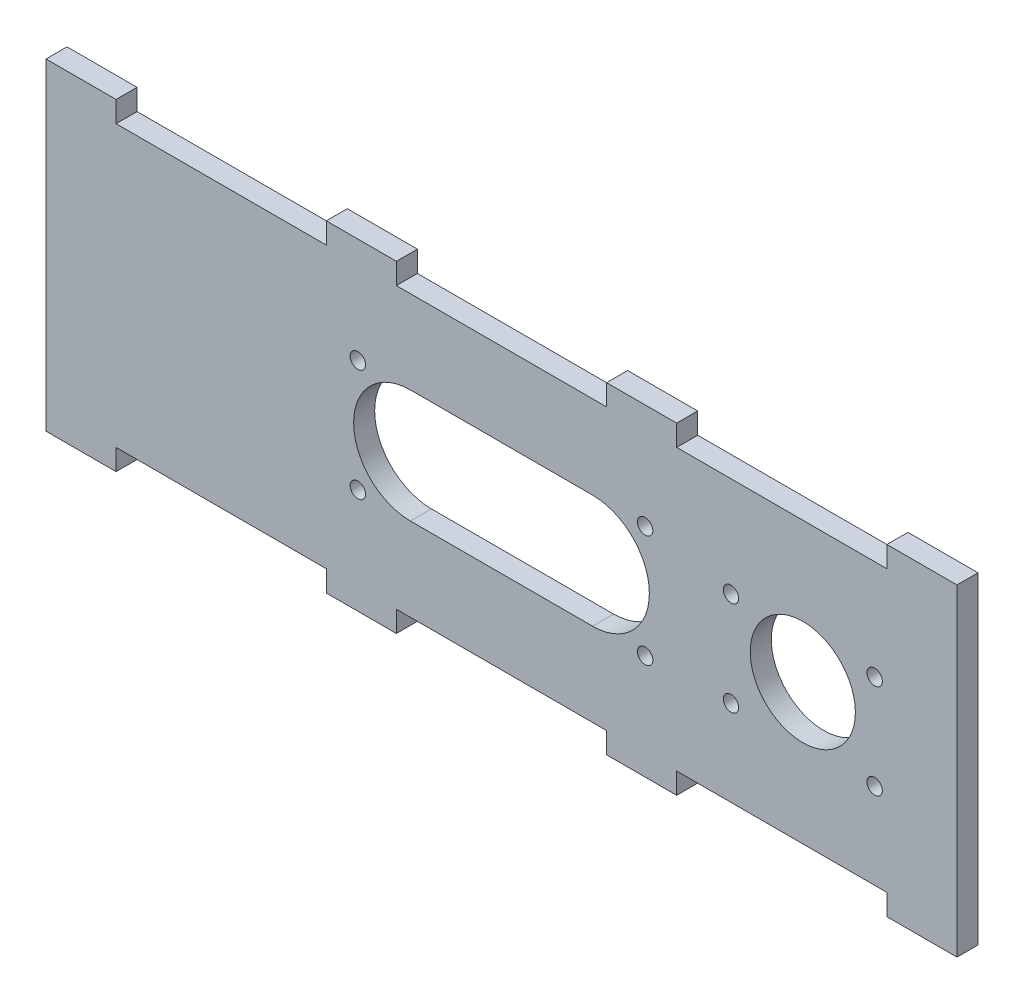
from build123d import *

# Parameters (mm, degrees)
SKETCH1_R           = 1.1
BOSS_EXTRUDE1_DEPTH = 3
SKETCH4_R           = 1.1
CUT_EXTRUDE2_DEPTH  = 70.014491232
SKETCH5_R           = 7.5
CUT_EXTRUDE3_DEPTH  = 70.014491232


with BuildPart() as part:
    # Sketch1 → Boss-Extrude1 (new body)
    with BuildSketch(Plane.XY):
        Polygon((-55, -20), (-25, -20), (-25, -23), (-15, -23), (-15, -20), (15, -20), (15, -23), (25, -23), (25, -20), (55, -20), (55, -23), (65, -23), (65, 23), (55, 23), (55, 20), (25, 20), (25, 23), (15, 23), (15, 20), (-15, 20), (-15, 23), (-25, 23), (-25, 20), (-55, 20), (-55, 23), (-65, 23), (-65, -23), (-55, -23), align=None)
        with Locations((32.75, 5.75)):
            Circle(SKETCH1_R, mode=Mode.SUBTRACT)
        with Locations((53.25, 5.75)):
            Circle(SKETCH1_R, mode=Mode.SUBTRACT)
        with Locations((53.25, -7.75)):
            Circle(SKETCH1_R, mode=Mode.SUBTRACT)
        with Locations((32.75, -7.75)):
            Circle(SKETCH1_R, mode=Mode.SUBTRACT)
    extrude(amount=BOSS_EXTRUDE1_DEPTH)

    # Sketch4 → Cut-Extrude2 (cut, through all)
    with BuildSketch(Plane.XY.offset(3)):
        with Locations((-20.5, 8)):
            Circle(SKETCH4_R)
        with Locations((-20.5, -8)):
            Circle(SKETCH4_R)
        with Locations((20.5, 8)):
            Circle(SKETCH4_R)
        with Locations((20.5, -8)):
            Circle(SKETCH4_R)
        with BuildLine():
            Line((-13, 8.1), (13, 8.1))
            ThreePointArc((13, 8.1), (21.1, 0), (13, -8.1))
            Line((13, -8.1), (-13, -8.1))
            ThreePointArc((-13, -8.1), (-21.1, 0), (-13, 8.1))
        make_face()
    extrude(amount=-CUT_EXTRUDE2_DEPTH, mode=Mode.SUBTRACT)

    # Sketch5 → Cut-Extrude3 (cut, through all)
    with BuildSketch(Plane.XY.offset(3)):
        with Locations((43, 0)):
            Circle(SKETCH5_R)
    extrude(amount=-CUT_EXTRUDE3_DEPTH, mode=Mode.SUBTRACT)


solid = part.part
